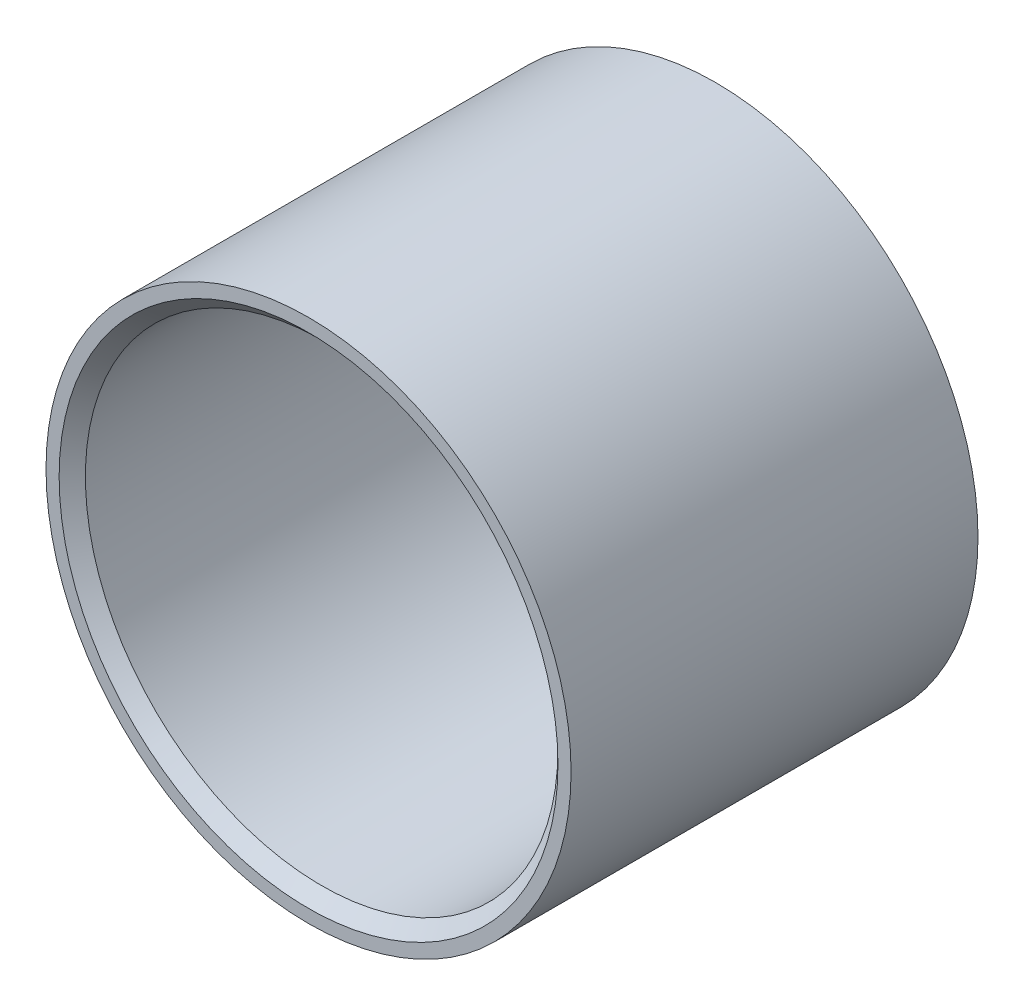
from build123d import *

# Parameters (mm, degrees)
IZIM1_R                     = 10
IZIM1_R_2                   = 9
Y_KSEKLIK_EKSTR_ZYON1_DEPTH = 15.5
PAH1_SIZE                   = 0.5


with BuildPart() as part:
    # Çizim1 → Yükseklik-Ekstrüzyon1 (new body)
    with BuildSketch(Plane.XY):
        Circle(IZIM1_R)
        Circle(IZIM1_R_2, mode=Mode.SUBTRACT)
    extrude(amount=Y_KSEKLIK_EKSTR_ZYON1_DEPTH)

    # Pah1
    pah1_edges = [part.edges().sort_by_distance(p)[0] for p in [
        (-9, 0, 15.5),
    ]]
    chamfer(pah1_edges, length=PAH1_SIZE)


solid = part.part
